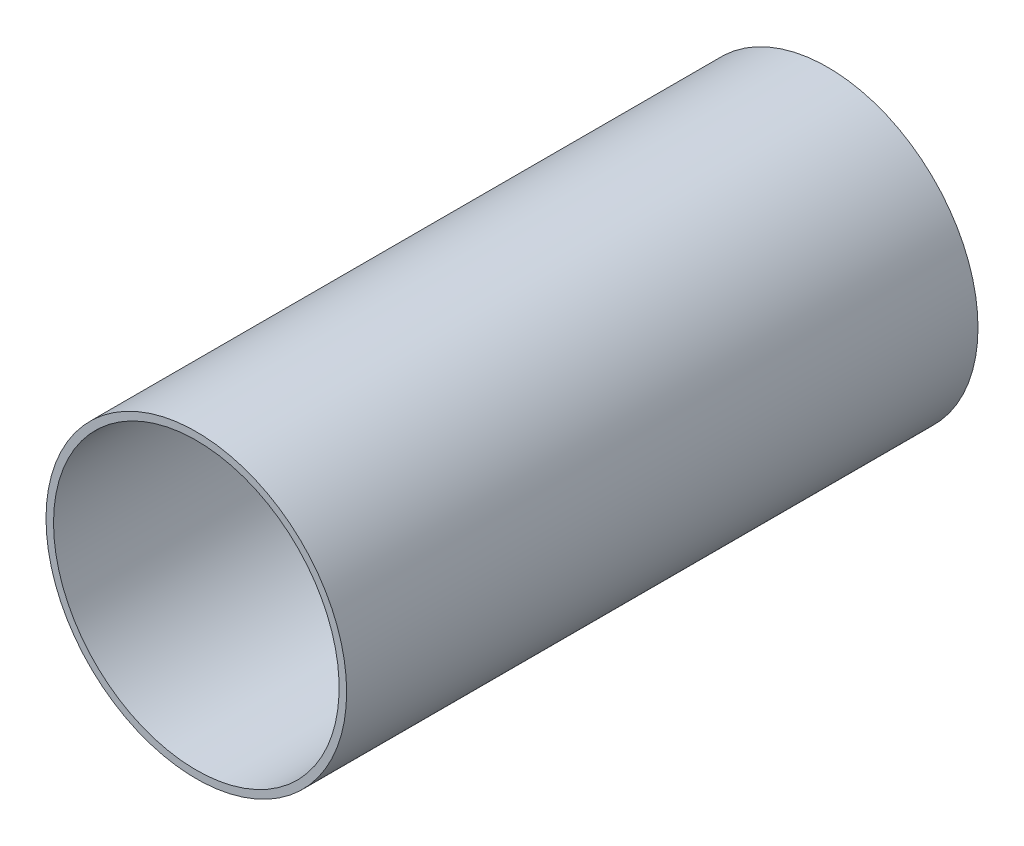
from build123d import *


with BuildPart() as part:
    # Sketch1 → Revolve1 (revolve)
    with BuildSketch(Plane(origin=(0, 0, 0), x_dir=(0, 0, -1), z_dir=(1, 0, 0)), mode=Mode.PRIVATE) as revolve1_sk:
        Polygon((133.35, 63.5), (-133.35, 63.5), (-133.35, 60.325), (-0.507683574, 60.325), (133.35, 60.325), align=None)
    revolve(revolve1_sk.sketch.rotate(Axis((0, 0, 0), (0, 0, 1)), 90), axis=Axis((0, 0, 0), (0, 0, 1)))


solid = part.part
